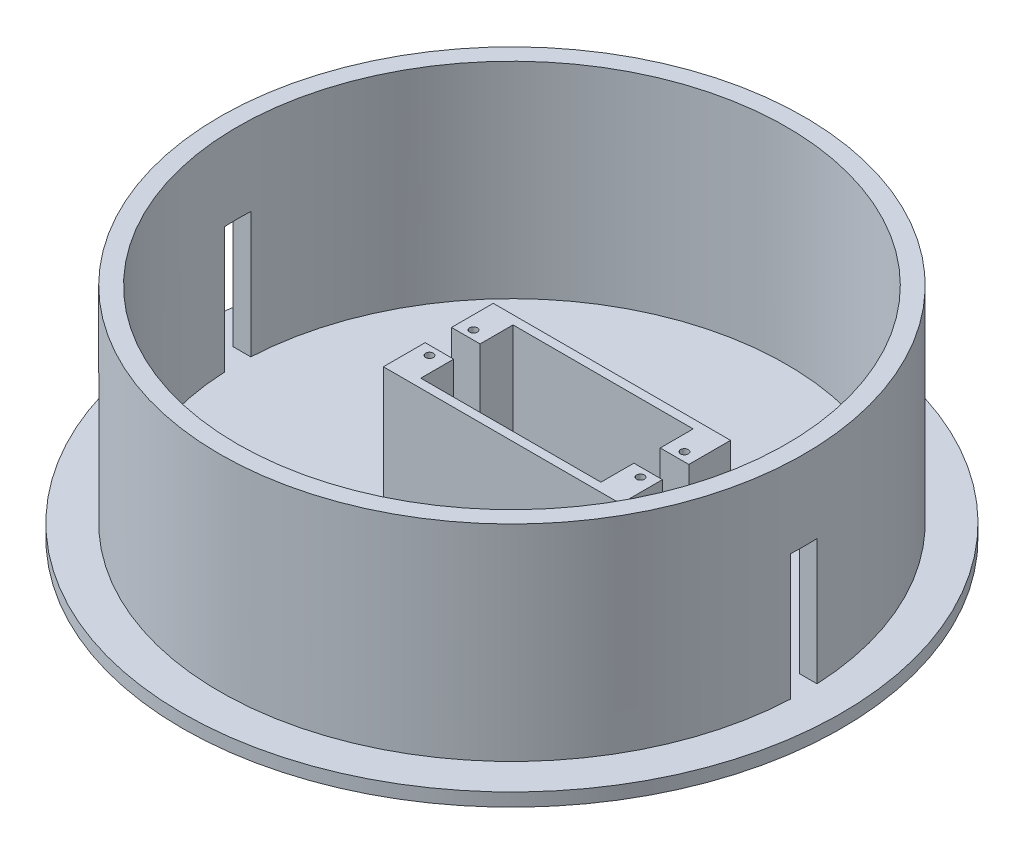
from build123d import *

# Parameters (mm, degrees)
SKETCH1_R               = 66.5
SKETCH1_R_2             = 62.5
BOSS_EXTRUDE1_DEPTH     = 46.8
SKETCH1_3_R             = 75
SKETCH1_3_R_2           = 66.5
BOSS_EXTRUDE2_DEPTH     = 3
BOSS_EXTRUDE3_START     = -3
SKETCH1_5_R             = 66.5
BOSS_EXTRUDE3_DEPTH     = 3
SKETCH2_W               = 54
SKETCH2_H               = 25
SKETCH2_R               = 0.875
SKETCH2_W_2             = 41
SKETCH2_H_2             = 21
BOSS_EXTRUDE4_DEPTH     = 28.65
CUT_EXTRUDE1_DEPTH      = 128.409978024
CUT_EXTRUDE1_DEPTH_BACK = 128.409978024
SKETCH3_W               = 6
SKETCH3_H               = 28.65


with BuildPart() as part:
    # Sketch1 → Boss-Extrude1 (new body)
    with BuildSketch(Plane(origin=(0, 0, 0), x_dir=(1, 0, 0), z_dir=(0, 1, 0))):
        Circle(SKETCH1_R)
        Circle(SKETCH1_R_2, mode=Mode.SUBTRACT)
    extrude(amount=BOSS_EXTRUDE1_DEPTH)



with BuildPart() as body_2:
    # Sketch1<3> → Boss-Extrude2 (new body)
    with BuildSketch(Plane(origin=(0, 0, 0), x_dir=(1, 0, 0), z_dir=(0, 1, 0))):
        Circle(SKETCH1_3_R)
        Circle(SKETCH1_3_R_2, mode=Mode.SUBTRACT)
    extrude(amount=-BOSS_EXTRUDE2_DEPTH)


with BuildPart() as part_1:
    add(part.part)

    add(body_2.part)  # Boss-Extrude3 merges body 2
    # Sketch1<5> → Boss-Extrude3 (add)
    with BuildSketch(Plane(origin=(0, 0, 0), x_dir=(1, 0, 0), z_dir=(0, 1, 0)).offset(BOSS_EXTRUDE3_START)):
        Circle(SKETCH1_5_R)
    extrude(amount=BOSS_EXTRUDE3_DEPTH)

    # Sketch2 → Boss-Extrude4 (add)
    with BuildSketch(Plane(origin=(0, 0, 0), x_dir=(1, 0, 0), z_dir=(0, 1, 0))):
        with Locations((10.25, 0)):
            Rectangle(SKETCH2_W, SKETCH2_H)
        with Locations((34.25, 5)):
            Circle(SKETCH2_R, mode=Mode.SUBTRACT)
        with Locations((34.25, -5)):
            Circle(SKETCH2_R, mode=Mode.SUBTRACT)
        with Locations((10.25, 0)):
            Rectangle(SKETCH2_W_2, SKETCH2_H_2, mode=Mode.SUBTRACT)
        with Locations((-13.75, 5)):
            Circle(SKETCH2_R, mode=Mode.SUBTRACT)
        with Locations((-13.75, -5)):
            Circle(SKETCH2_R, mode=Mode.SUBTRACT)
    extrude(amount=BOSS_EXTRUDE4_DEPTH)

    # Sketch3 → Cut-Extrude1 (cut, two sides: drawn at the far end of the back side and taken through both)
    with BuildSketch(Plane.ZY.offset(16.75).offset(-CUT_EXTRUDE1_DEPTH_BACK)):
        with Locations((0, 14.325)):
            Rectangle(SKETCH3_W, SKETCH3_H)
    extrude(amount=CUT_EXTRUDE1_DEPTH + CUT_EXTRUDE1_DEPTH_BACK, mode=Mode.SUBTRACT)


solid = part_1.part
